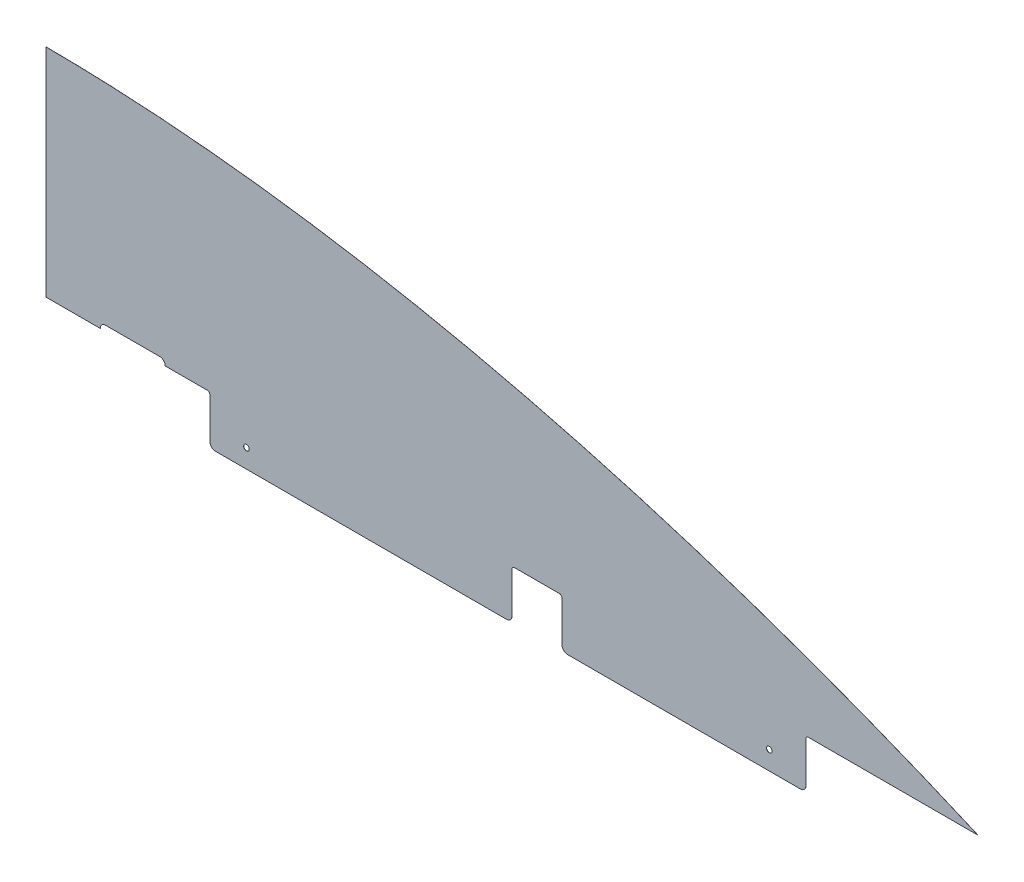
from build123d import *

# Parameters (mm, degrees)
BOSS_EXTRUDE1_DEPTH      = 0.127
CUT_EXTRUDE2_DEPTH       = 1122.346002088
SKETCH8_W                = 698.5
SKETCH8_H                = 57.15
BOSS_EXTRUDE3_DEPTH      = 0.127
SKETCH12_W               = 58.7375
SKETCH12_H               = 57.15
CUT_EXTRUDE3_DEPTH       = 1122.346002088
FILLET2_R                = 3.175
FILLET3_R                = 6.35
F_0_257_DIAMETER_HOLE2_D = 6.5278


with BuildPart() as part:
    # Sketch1 → Boss-Extrude1 (new body)
    with BuildSketch(Plane.XY):
        with BuildLine():
            Line((0, 254), (0, 0))
            Line((0, 0), (1092.2, 0))
            add(Edge.make_bspline(
                [(0, 254), (376.513153864, 252.276375478), (770.285770075, 140.499670678), (1092.2, 0)],
                knots=[0, 0, 0, 0, 1, 1, 1, 1], degree=3))
        make_face()
    extrude(amount=BOSS_EXTRUDE1_DEPTH)

    # Sketch7 → Cut-Extrude2 (cut, through all)
    with BuildSketch(Plane(origin=(0, 0, 0), x_dir=(-1, 0, 0), z_dir=(0, 0, -1))):
        with BuildLine():
            Line((-133.35, 0), (-63.5, 0))
            ThreePointArc((-63.5, 0), (-65.359871939, 4.490128061), (-69.85, 6.35))
            Line((-69.85, 6.35), (-133.35, 6.35))
            ThreePointArc((-133.35, 6.35), (-137.840128061, 4.490128061), (-139.7, 0))
            Line((-139.7, 0), (-133.35, 0))
        make_face()
    extrude(amount=-CUT_EXTRUDE2_DEPTH, mode=Mode.SUBTRACT)

    # Sketch8 → Boss-Extrude3 (add)
    with BuildSketch(Plane.XY.offset(0.127)):
        with Locations((541.3375, -28.575)):
            Rectangle(SKETCH8_W, SKETCH8_H)
    extrude(amount=-BOSS_EXTRUDE3_DEPTH)

    # Sketch12 → Cut-Extrude3 (cut, through all)
    with BuildSketch(Plane.XY.offset(0.127)):
        with Locations((575.46875, -28.575)):
            Rectangle(SKETCH12_W, SKETCH12_H)
    extrude(amount=-CUT_EXTRUDE3_DEPTH, mode=Mode.SUBTRACT)

    # Fillet2
    fillet2_edges = [part.edges().sort_by_distance(p)[0] for p in [
        (192.0875, 0, 0.0635),
        (890.5875, 0, 0.0635),
        (604.8375, 0, 0.0635),
        (546.1, 0, 0.0635),
    ]]
    fillet(fillet2_edges, radius=FILLET2_R)

    # Fillet3
    fillet3_edges = [part.edges().sort_by_distance(p)[0] for p in [
        (192.0875, -57.15, 0.0635),
        (890.5875, -57.15, 0.0635),
        (604.8375, -57.15, 0.0635),
        (546.1, -57.15, 0.0635),
    ]]
    fillet(fillet3_edges, radius=FILLET3_R)

    # F (0.257) Diameter Hole2 (through all)
    with Locations(Plane(origin=(0, 0, 0), x_dir=(-1, 0, 0), z_dir=(0, 0, -1))):
        with Locations((-847.725, -35.306), (-234.95, -35.306)):
            Hole(F_0_257_DIAMETER_HOLE2_D / 2)


solid = part.part
